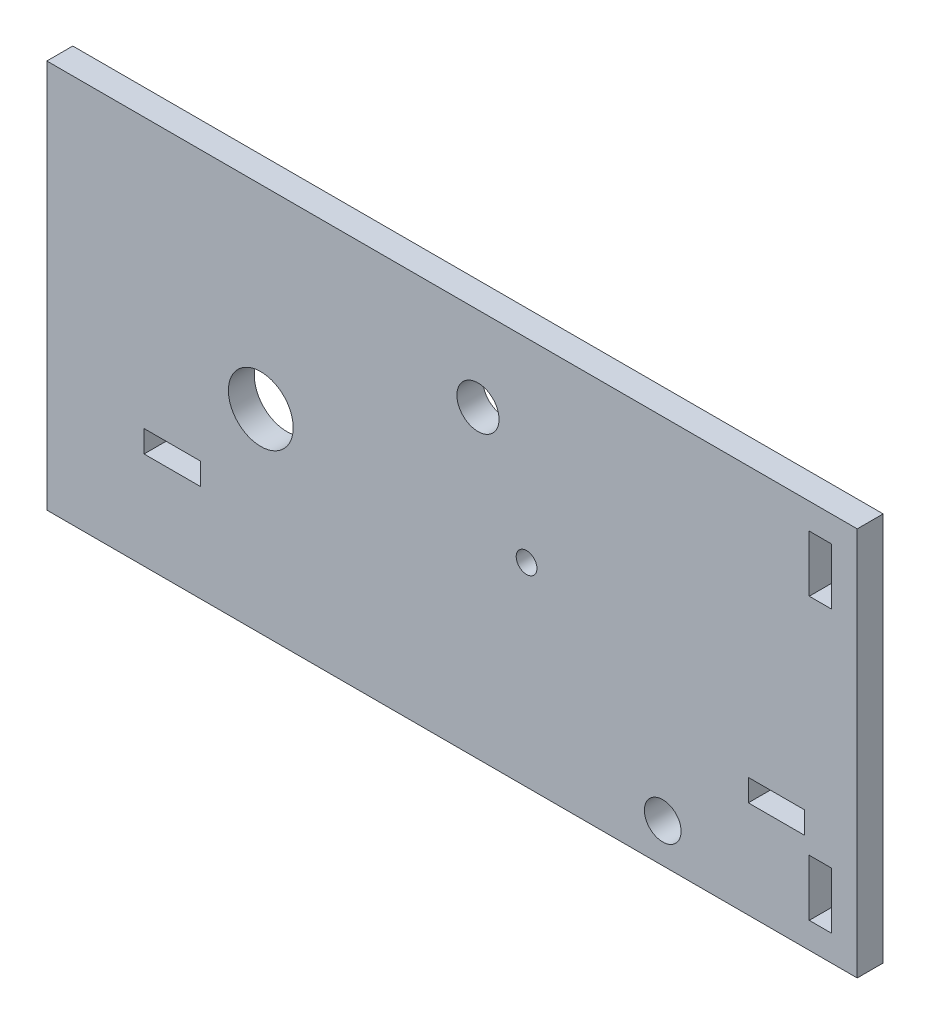
from build123d import *

# Parameters (mm, degrees)
SKETCH1_W               = 121
SKETCH1_H               = 60
SKETCH1_R               = 5
SKETCH1_R_2             = 3.25
SKETCH1_R_3             = 2.83
SKETCH1_R_4             = 1.6
SKETCH1_W_2             = 8.7
SKETCH1_H_2             = 3.4
BOSS_EXTRUDE1_DEPTH     = 4
SKETCH2_W               = 4
SKETCH2_H               = 60
BOSS_EXTRUDE2_DEPTH     = 4
CUT_EXTRUDE2_DEPTH      = 85.599054368
CUT_EXTRUDE2_DEPTH_BACK = 85.599054368
SKETCH3_W               = 3.4
SKETCH3_H               = 8.7


with BuildPart() as part:
    # Sketch1 → Boss-Extrude1 (new body)
    with BuildSketch(Plane.XY):
        with Locations((-18.5, 0)):
            Rectangle(SKETCH1_W, SKETCH1_H)
        with Locations((-46, 0)):
            Circle(SKETCH1_R, mode=Mode.SUBTRACT)
        with Locations((-12.5, 17)):
            Circle(SKETCH1_R_2, mode=Mode.SUBTRACT)
        with Locations((16, -24)):
            Circle(SKETCH1_R_3, mode=Mode.SUBTRACT)
        with Locations((-5, 0)):
            Circle(SKETCH1_R_4, mode=Mode.SUBTRACT)
        with Locations((-59.65, -13.3)):
            Rectangle(SKETCH1_W_2, SKETCH1_H_2, mode=Mode.SUBTRACT)
        with Locations((33.55, -13.3)):
            Rectangle(SKETCH1_W_2, SKETCH1_H_2, mode=Mode.SUBTRACT)
    extrude(amount=BOSS_EXTRUDE1_DEPTH)

    # Sketch2 → Boss-Extrude2 (add)
    with BuildSketch(Plane.XY):
        with Locations((44, 0)):
            Rectangle(SKETCH2_W, SKETCH2_H)
    extrude(amount=BOSS_EXTRUDE2_DEPTH)

    # Sketch3 → Cut-Extrude2 (cut, two sides: drawn at the far end of the back side and taken through both)
    with BuildSketch(Plane.XY.offset(-CUT_EXTRUDE2_DEPTH_BACK)):
        with Locations((40.3, 21.65)):
            Rectangle(SKETCH3_W, SKETCH3_H)
        with Locations((40.3, -21.65)):
            Rectangle(SKETCH3_W, SKETCH3_H)
    extrude(amount=CUT_EXTRUDE2_DEPTH + CUT_EXTRUDE2_DEPTH_BACK, mode=Mode.SUBTRACT)


solid = part.part
